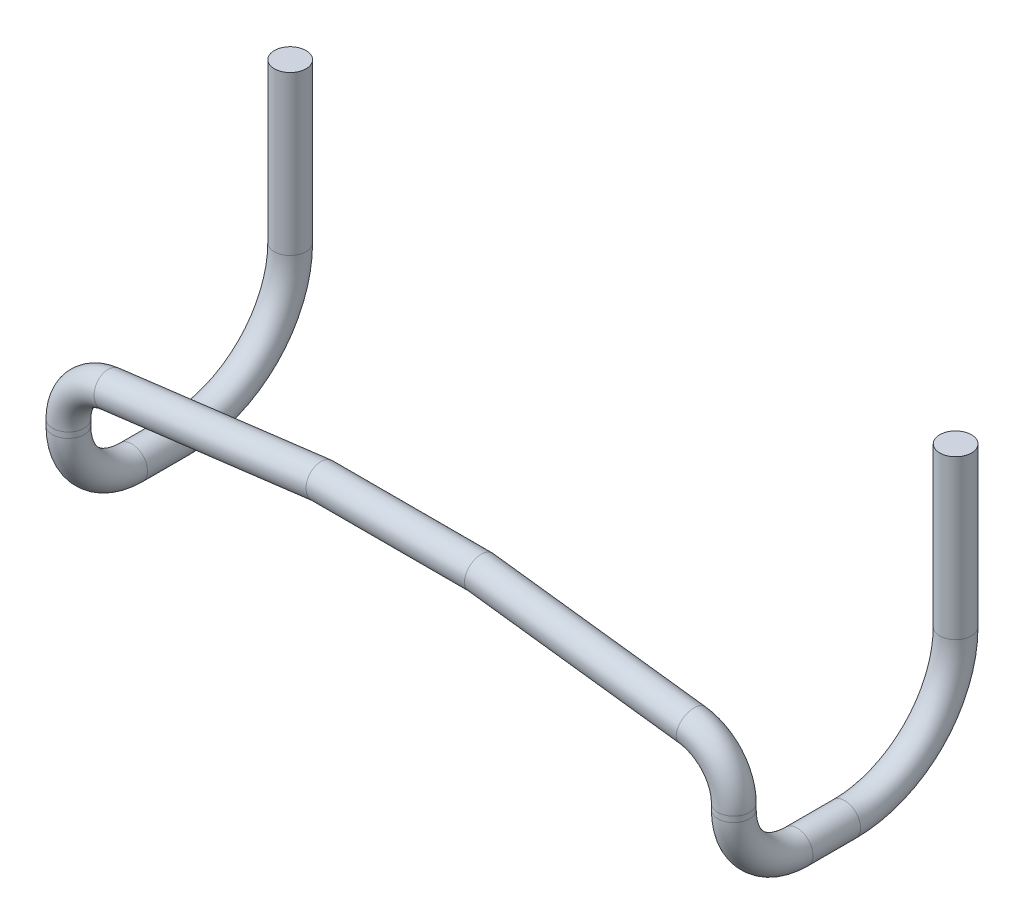
from build123d import *

# Parameters (mm, degrees)
SWEEP1_PROFILE_R = 10


with BuildPart() as part:
    # Sweep1: sweep along a curve in space
    with BuildLine() as sweep1_path:
        Line((0, 0, 0), (50, 0, 0))
        Line((50, 0, 0), (183.721042038, -16.715130255, 0))
        ThreePointArc((183.721042038, -16.715130255, 0), (202.490345274, -26.629389659, 0), (210, -46.483466556, 0))
        Line((210, -46.483466556, 0), (210, -50, 0))
        ThreePointArc((210, -50, 0), (210, -78.284271247, -11.715728753), (210, -90, -40))
        Line((210, -90, -40), (210, -90, -70))
        ThreePointArc((210, -90, -70), (210, -69.497474683, -119.497474683), (210, -20, -140))
        Line((210, -20, -140), (210, 80, -140))
    # Sweep1 profile (on start of the path) → Sweep1 (sweep)
    with BuildSketch(Plane(origin=(0, 0, 0), x_dir=(0, 0, 1), z_dir=(1, 0, 0))):
        Circle(SWEEP1_PROFILE_R)
    sweep1 = sweep(path=sweep1_path.line, transition=Transition.RIGHT)

    # Mirror1: Sweep1 across plane
    add(sweep1.mirror(Plane.ZY))


solid = part.part
